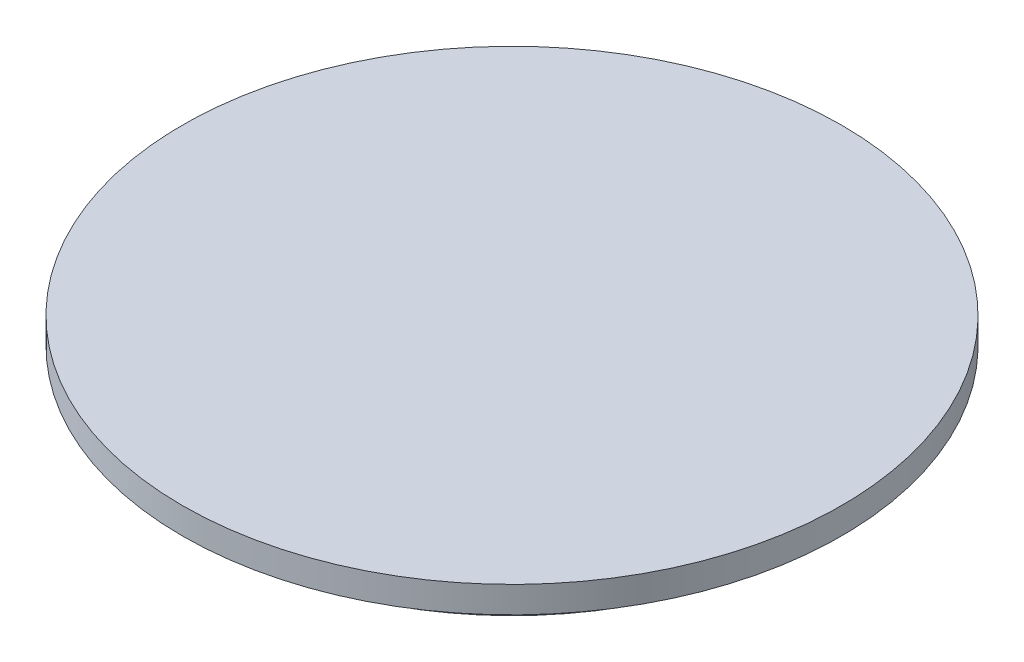
from build123d import *


with BuildPart() as part:
    # Esquisse2 → Révolution1 (revolve)
    with BuildSketch(Plane.XY, mode=Mode.PRIVATE) as r_volution1_sk:
        Polygon((0, 0), (8.9, 0), (8.9, 0.8), (10, 0.8), (10, 1.6), (0, 1.6), align=None)
    revolve(r_volution1_sk.sketch.rotate(Axis((0, 1.6, 0), (0, -1, 0)), 90), axis=Axis((0, 1.6, 0), (0, -1, 0)))


solid = part.part
